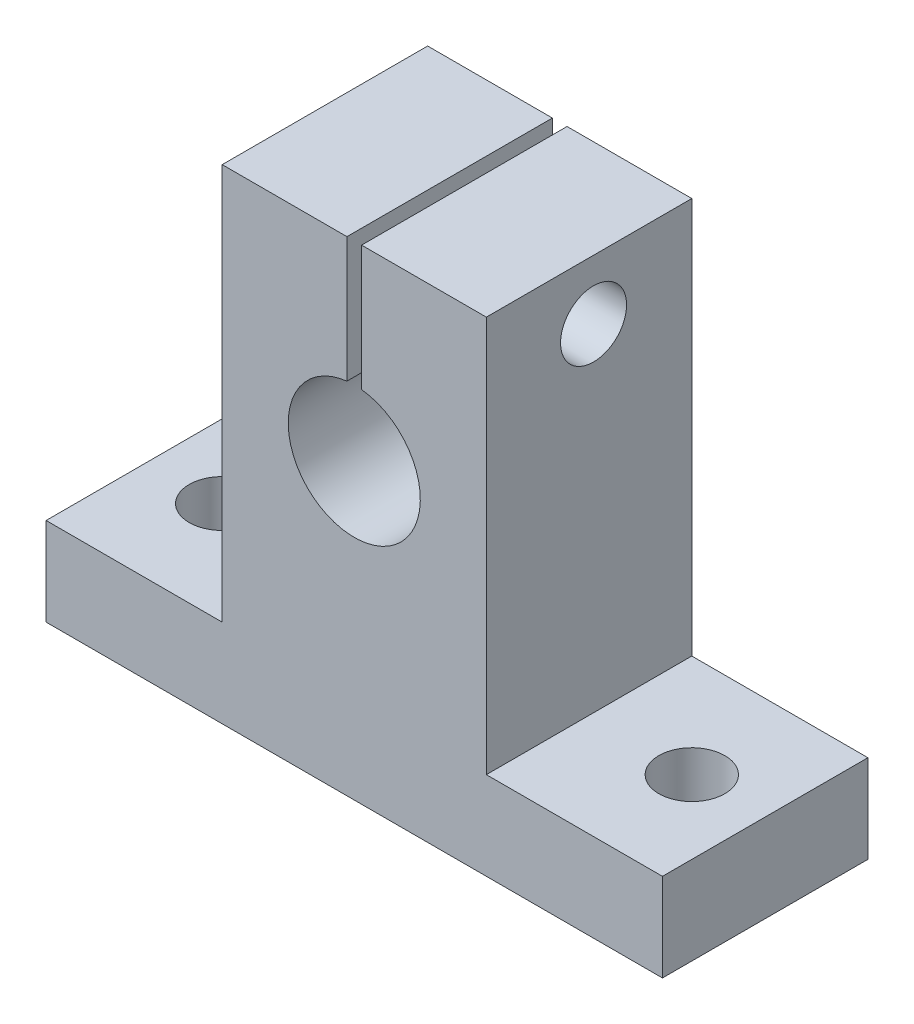
from build123d import *

# Parameters (mm, degrees)
SKETCH1_W           = 18
SKETCH1_H           = 27
SKETCH1_R           = 4.5
SKETCH1_W_2         = 42
SKETCH1_H_2         = 6
BOSS_EXTRUDE1_DEPTH = 14
SKETCH2_R           = 2.25
CUT_EXTRUDE1_DEPTH  = 37.959437225
CUT_EXTRUDE2_DEPTH  = 40.204591568
CUT_EXTRUDE3_REACH  = 46.677
SKETCH4_R           = 2.25


with BuildPart() as part:
    # Sketch1 → Boss-Extrude1 (new body)
    # profile 1 of 2: a face of its own
    with BuildSketch(Plane.XY):
        with Locations((0, 16.5)):
            Rectangle(SKETCH1_W, SKETCH1_H)
        with Locations((0, 17)):
            Circle(SKETCH1_R, mode=Mode.SUBTRACT)
    # profile 2 of 2: a face of its own
    with BuildSketch(Plane.XY):
        Rectangle(SKETCH1_W_2, SKETCH1_H_2)
    extrude(amount=BOSS_EXTRUDE1_DEPTH)

    # Sketch2 → Cut-Extrude1 (cut, through all)
    with BuildSketch(Plane(origin=(0, 3, 0), x_dir=(1, 0, 0), z_dir=(0, 1, 0))):
        with Locations(Location((-16, -7, 0), (0, 0, 270))):
            Circle(SKETCH2_R)
        with Locations(Location((16, -7, 0), (0, 0, 90))):
            Circle(SKETCH2_R)
    extrude(amount=-CUT_EXTRUDE1_DEPTH, mode=Mode.SUBTRACT)

    # Sketch3 → Cut-Extrude2 (cut, through all)
    with BuildSketch(Plane.XY.offset(14)):
        with BuildLine():
            Line((0.5, 30), (0.5, 21.472135955))
            ThreePointArc((0.5, 21.472135955), (0, 21.5), (-0.5, 21.472135955))
            Line((-0.5, 21.472135955), (-0.5, 30))
            Line((-0.5, 30), (0.5, 30))
        make_face()
    extrude(amount=-CUT_EXTRUDE2_DEPTH, mode=Mode.SUBTRACT)

    # Cut-Extrude3: up to this face of the body (flat: up to its plane)
    cut_extrude3_end = Plane(part.part.faces().sort_by_distance((-9, 16.5, 7))[0])
    # Sketch4 → Cut-Extrude3 (cut, up to the picked face)
    with BuildSketch(Plane(origin=(9, 0, 0), x_dir=(0, 0, -1), z_dir=(1, 0, 0)), mode=Mode.PRIVATE) as cut_extrude3_sk1:
        with Locations((-6.695292014, 25.95)):
            Circle(SKETCH4_R)
    cut_extrude3_tool1 = split(extrude(cut_extrude3_sk1.sketch, amount=-CUT_EXTRUDE3_REACH, mode=Mode.PRIVATE), bisect_by=cut_extrude3_end, keep=Keep.BOTH, mode=Mode.PRIVATE)
    add(cut_extrude3_tool1.solids().sort_by(Axis((9, 25.95, 6.695292), (-1, 0, 0)))[0], mode=Mode.SUBTRACT)


solid = part.part
